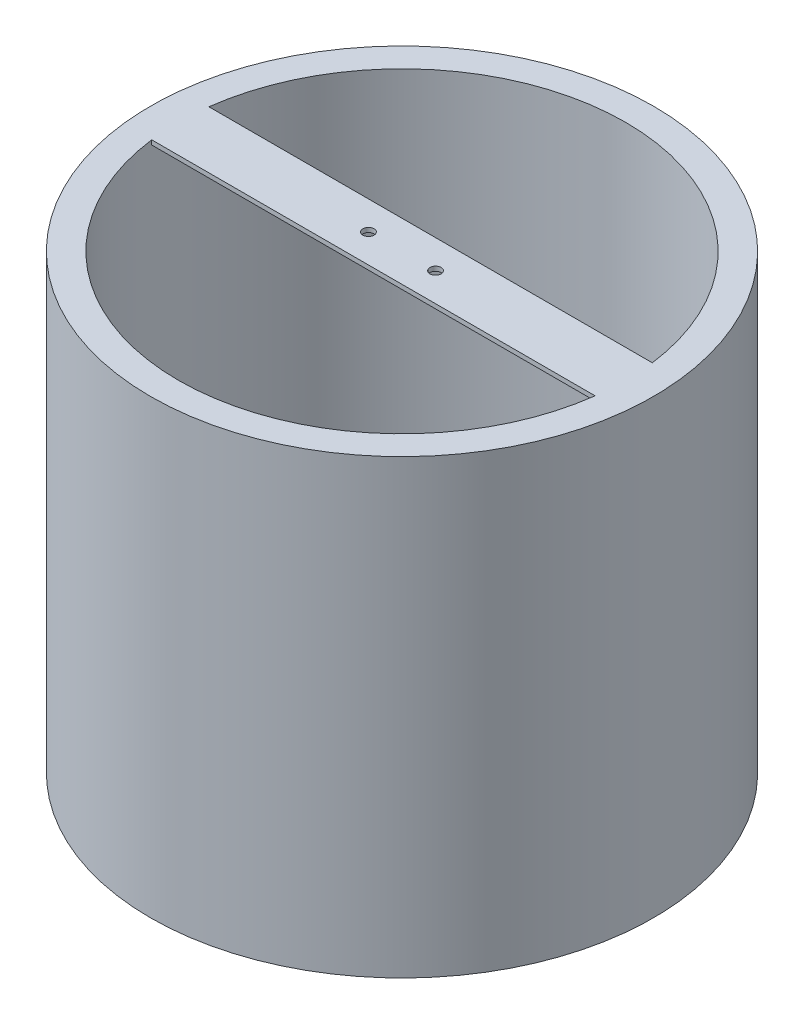
from build123d import *

# Parameters (mm, degrees)
SKETCH2_R           = 57.15
SKETCH2_R_2         = 50.8
BOSS_EXTRUDE1_DEPTH = 101.6
SKETCH4_R           = 57.15
SKETCH4_R_2         = 50.8
BOSS_EXTRUDE2_DEPTH = 1.016
SKETCH5_R           = 1.27
CUT_EXTRUDE2_DEPTH  = 14.732


with BuildPart() as part:
    # Sketch2 → Boss-Extrude1 (new body)
    with BuildSketch(Plane(origin=(0, 0, 0), x_dir=(1, 0, 0), z_dir=(0, 1, 0))):
        with Locations(Location((0, 0, 0), (0, 0, 270))):
            Circle(SKETCH2_R)
        with Locations(Location((0, 0, 0), (0, 0, 270))):
            Circle(SKETCH2_R_2, mode=Mode.SUBTRACT)
    extrude(amount=BOSS_EXTRUDE1_DEPTH)

    # Sketch4 → Boss-Extrude2 (add)
    # profile 1 of 2: a face of its own
    with BuildSketch(Plane(origin=(0, 101.6, 0), x_dir=(1, 0, 0), z_dir=(0, 1, 0))):
        with Locations(Location((0, 0, 0), (0, 0, 270))):
            Circle(SKETCH4_R)
        with Locations(Location((0, 0, 0), (0, 0, 172.649423361))):
            Circle(SKETCH4_R_2, mode=Mode.SUBTRACT)
    # profile 2 of 2: a face of its own
    with BuildSketch(Plane(origin=(0, 101.6, 0), x_dir=(1, 0, 0), z_dir=(0, 1, 0))):
        with BuildLine():
            Line((-50.382520142, -6.499358748), (0, -6.499358748))
            Line((0, -6.499358748), (50.382520142, -6.499358748))
            ThreePointArc((50.382520142, -6.499358748), (50.695522599, -3.256376574), (50.8, 0))
            ThreePointArc((50.8, 0), (50.695522599, 3.256376574), (50.382520142, 6.499358748))
            Line((50.382520142, 6.499358748), (-50.382520142, 6.499358748))
            ThreePointArc((-50.382520142, 6.499358748), (-50.8, 0), (-50.382520142, -6.499358748))
        make_face()
    extrude(amount=BOSS_EXTRUDE2_DEPTH)

    # Sketch5 → Cut-Extrude2 (cut)
    with BuildSketch(Plane(origin=(0, 102.616, 0), x_dir=(1, 0, 0), z_dir=(0, 1, 0))):
        with Locations(Location((7.62, 0, 0), (0, 0, 270))):
            Circle(SKETCH5_R)
        with Locations(Location((-7.62, 0, 0), (0, 0, 270))):
            Circle(SKETCH5_R)
    extrude(amount=-CUT_EXTRUDE2_DEPTH, mode=Mode.SUBTRACT)


solid = part.part
